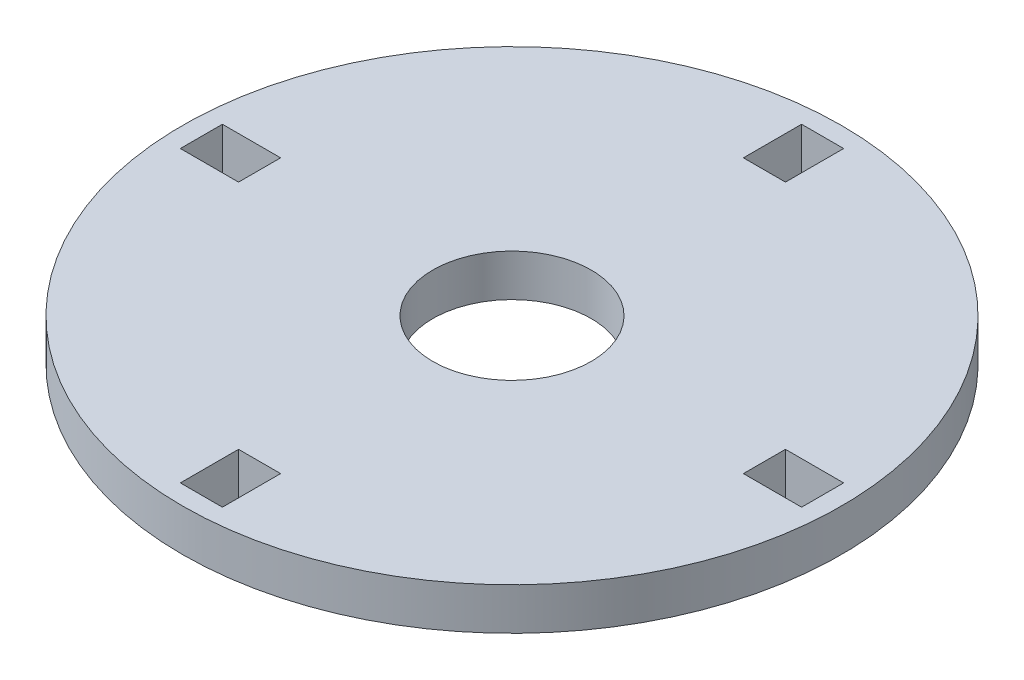
from build123d import *

# Parameters (mm, degrees)
SKICA1_R                 = 23.5
P_IDAT_VYSUNUT_M1_DEPTH  = 3
SKICA2_R                 = 5.65
ODEBRAT_VYSUNUT_M1_DEPTH = 3
SKICA3_W                 = 4.15
SKICA3_H                 = 3
SKICA3_W_2               = 3
SKICA3_H_2               = 4.15
ODEBRAT_VYSUNUT_M2_DEPTH = 3


with BuildPart() as part:
    # Skica1 → Přidat vysunutím1 (new body)
    with BuildSketch(Plane(origin=(0, 0, 0), x_dir=(1, 0, 0), z_dir=(0, 1, 0))):
        with Locations(Location((0, 0, 0), (0, 0, 270))):
            Circle(SKICA1_R)
    extrude(amount=P_IDAT_VYSUNUT_M1_DEPTH)

    # Skica2 → Odebrat vysunutím1 (cut)
    with BuildSketch(Plane(origin=(0, 3, 0), x_dir=(1, 0, 0), z_dir=(0, 1, 0))):
        with Locations(Location((0, 0, 0), (0, 0, 270))):
            Circle(SKICA2_R)
    extrude(amount=-ODEBRAT_VYSUNUT_M1_DEPTH, mode=Mode.SUBTRACT)

    # Skica3 → Odebrat vysunutím2 (cut)
    with BuildSketch(Plane.XZ):
        with Locations((20.075, 0)):
            Rectangle(SKICA3_W, SKICA3_H)
        with Locations((0, 20.075)):
            Rectangle(SKICA3_W_2, SKICA3_H_2)
        with Locations((0, -20.075)):
            Rectangle(SKICA3_W_2, SKICA3_H_2)
        with Locations((-20.075, 0)):
            Rectangle(SKICA3_W, SKICA3_H)
    extrude(amount=-ODEBRAT_VYSUNUT_M2_DEPTH, mode=Mode.SUBTRACT)


solid = part.part
